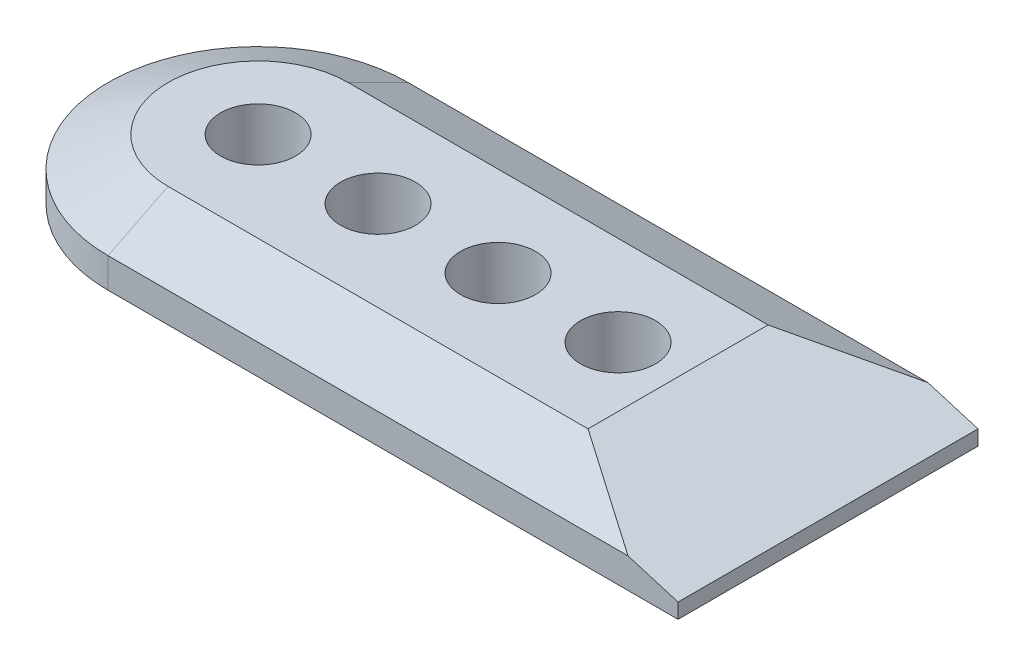
from build123d import *
from OCP.BRepFilletAPI import BRepFilletAPI_MakeChamfer

# Parameters (mm, degrees)
BOSS_EXTRUDE2_DEPTH = 12.7
CHAMFER3_SIZE       = 6.35
CHAMFER3_SIZE2      = 12.7
CHAMFER4_SIZE       = 9.525
CHAMFER4_SIZE2      = 31.75
SKETCH6_R           = 7.9375
CUT_EXTRUDE1_DEPTH  = 126.402452129


with BuildPart() as part:
    # Sketch3 → Boss-Extrude2 (new body)
    with BuildSketch(Plane(origin=(0, 0, 0), x_dir=(1, 0, 0), z_dir=(0, 1, 0))):
        with BuildLine():
            Line((0, 31.75), (120.65, 31.75))
            Line((120.65, 31.75), (120.65, -31.75))
            Line((120.65, -31.75), (0, -31.75))
            ThreePointArc((0, -31.75), (-31.75, 0), (0, 31.75))
        make_face()
    extrude(amount=BOSS_EXTRUDE2_DEPTH)

    # Chamfer3: one chamfer whose edges measure the first distance from different faces: ONE call of the kernel's chamfer builder (chamfer() names one face for all edges)
    chamfer3_edges_1 = [part.edges().sort_by_distance(p)[0] for p in [
        (60.325, 12.7, -31.75),
    ]]
    chamfer3_side_1 = [part.faces().sort_by_distance(p)[0] for p in [
        (60.325, 6.35, -31.75),
    ]]
    chamfer3_edges_2 = [part.edges().sort_by_distance(p)[0] for p in [
        (-31.75, 12.7, 0),
    ]]
    chamfer3_side_2 = [part.faces().sort_by_distance(p)[0] for p in [
        (-31.75, 6.35, 0),
    ]]
    chamfer3_edges_3 = [part.edges().sort_by_distance(p)[0] for p in [
        (60.325, 12.7, 31.75),
    ]]
    chamfer3_side_3 = [part.faces().sort_by_distance(p)[0] for p in [
        (60.325, 6.35, 31.75),
    ]]
    chamfer3 = BRepFilletAPI_MakeChamfer(part.part.solid().wrapped)
    for e in chamfer3_edges_1:
        chamfer3.Add(CHAMFER3_SIZE, CHAMFER3_SIZE2, e.wrapped, chamfer3_side_1[0].wrapped)  # the first distance lies on this face
    for e in chamfer3_edges_2:
        chamfer3.Add(CHAMFER3_SIZE, CHAMFER3_SIZE2, e.wrapped, chamfer3_side_2[0].wrapped)  # the first distance lies on this face
    for e in chamfer3_edges_3:
        chamfer3.Add(CHAMFER3_SIZE, CHAMFER3_SIZE2, e.wrapped, chamfer3_side_3[0].wrapped)  # the first distance lies on this face
    add(Compound.cast(chamfer3.Shape()), mode=Mode.REPLACE)

    # Chamfer4
    chamfer4_edges = [part.edges().sort_by_distance(p)[0] for p in [
        (120.65, 12.7, 0),
    ]]
    chamfer4_side = [part.faces().sort_by_distance(p)[0] for p in [
        (120.65, 5.87962963, 0),
    ]]
    chamfer(chamfer4_edges, length=CHAMFER4_SIZE, length2=CHAMFER4_SIZE2, reference=chamfer4_side[0])

    # Sketch6 → Cut-Extrude1 (cut, through all)
    with BuildSketch(Plane(origin=(0, 12.7, 0), x_dir=(1, 0, 0), z_dir=(0, 1, 0))):
        with Locations(Location((0, 0, 0), (0, 0, 270))):
            Circle(SKETCH6_R)
        with Locations(Location((25.4, 0, 0), (0, 0, 270))):
            Circle(SKETCH6_R)
        with Locations(Location((50.8, 0, 0), (0, 0, 270))):
            Circle(SKETCH6_R)
        with Locations(Location((76.2, 0, 0), (0, 0, 270))):
            Circle(SKETCH6_R)
    extrude(amount=-CUT_EXTRUDE1_DEPTH, mode=Mode.SUBTRACT)


solid = part.part
